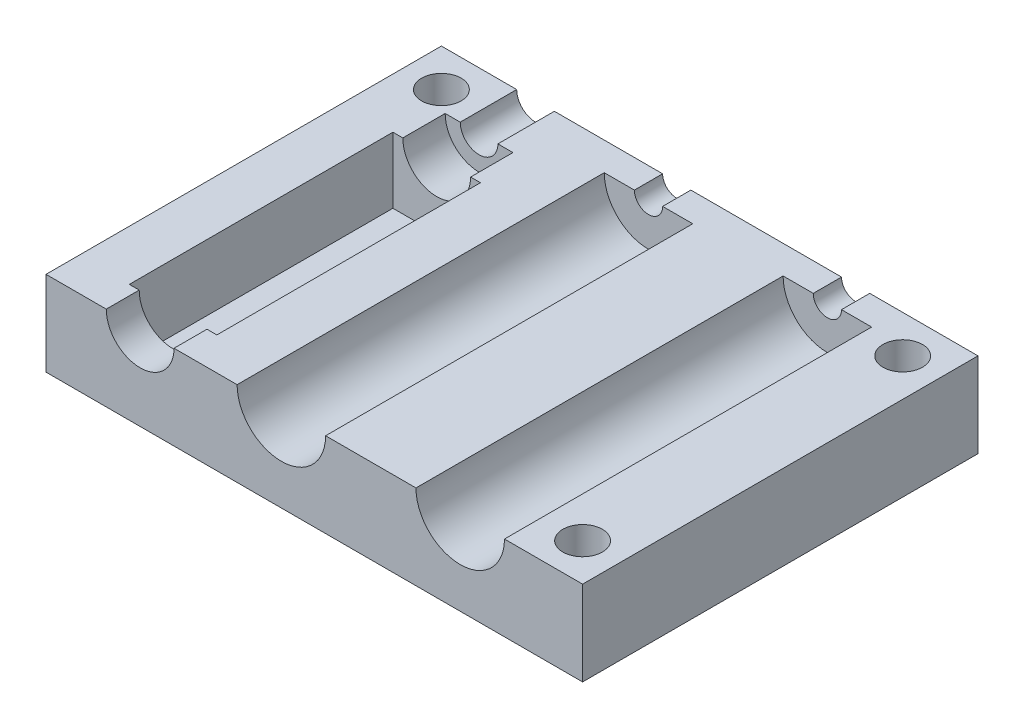
from build123d import *

# Parameters (mm, degrees)
SALIENTE_EXTRUIR1_DEPTH = 39
CROQUIS2_W              = 9.3
CROQUIS2_H              = 28
CORTAR_EXTRUIR1_DEPTH   = 7
SALIENTE_EXTRUIR4_DEPTH = 3
SALIENTE_EXTRUIR5_DEPTH = 3
CROQUIS4_R              = 2.1
CORTAR_EXTRUIR2_DEPTH   = 52.548520832


with BuildPart() as part:
    # Croquis1 → Saliente-Extruir1 (new body)
    with BuildSketch(Plane.XY):
        with BuildLine():
            Line((-22.1, 1), (-28.5, 1))
            Line((-28.5, 1), (-28.5, -8))
            Line((-28.5, -8), (28.5, -8))
            Line((28.5, -8), (28.5, 1))
            Line((28.5, 1), (20.2, 1))
            ThreePointArc((20.2, 1), (15.5, -3.7), (10.8, 1))
            Line((10.8, 1), (1.2, 1))
            ThreePointArc((1.2, 1), (-3.5, -3.7), (-8.2, 1))
            Line((-8.2, 1), (-14.9, 1))
            ThreePointArc((-14.9, 1), (-18.5, -2.6), (-22.1, 1))
        make_face()
    extrude(amount=-SALIENTE_EXTRUIR1_DEPTH)

    # Croquis2 → Cortar-Extruir1 (cut)
    with BuildSketch(Plane(origin=(0, 1, 0), x_dir=(1, 0, 0), z_dir=(0, 1, 0))):
        with Locations((-18.5, 17.5)):
            Rectangle(CROQUIS2_W, CROQUIS2_H)
    extrude(amount=-CORTAR_EXTRUIR1_DEPTH, mode=Mode.SUBTRACT)

    # Croquis3 → Saliente-Extruir4 (add)
    with BuildSketch(Plane(origin=(0, 0, -39), x_dir=(-1, 0, 0), z_dir=(0, 0, -1))):
        with BuildLine():
            Line((-28.5, 1), (-28.5, -8))
            Line((-28.5, -8), (13.5, -8))
            Line((13.5, -8), (13.5, 1))
            Line((13.5, 1), (5, 1))
            ThreePointArc((5, 1), (3.5, -0.5), (2, 1))
            Line((2, 1), (-14, 1))
            ThreePointArc((-14, 1), (-15.5, -0.5), (-17, 1))
            Line((-17, 1), (-28.5, 1))
        make_face()
    extrude(amount=SALIENTE_EXTRUIR4_DEPTH)

    # Croquis3<4> → Saliente-Extruir5 (add, symmetric)
    with BuildSketch(Plane(origin=(0, 0, -39), x_dir=(-1, 0, 0), z_dir=(0, 0, -1))):
        with BuildLine():
            Line((13.5, 1), (13.5, -8))
            Line((13.5, -8), (28.5, -8))
            Line((28.5, -8), (28.5, 1))
            Line((28.5, 1), (20.5, 1))
            ThreePointArc((20.5, 1), (18.5, -1), (16.5, 1))
            Line((16.5, 1), (13.5, 1))
        make_face()
    extrude(amount=SALIENTE_EXTRUIR5_DEPTH, both=True)

    # Croquis4 → Cortar-Extruir2 (cut, through all)
    with BuildSketch(Plane(origin=(0, 1, 0), x_dir=(1, 0, 0), z_dir=(0, 1, 0))):
        with Locations((-24.5, 38)):
            Circle(CROQUIS4_R)
        with Locations((24.5, 38)):
            Circle(CROQUIS4_R)
        with Locations((24.5, 4)):
            Circle(CROQUIS4_R)
    extrude(amount=-CORTAR_EXTRUIR2_DEPTH, mode=Mode.SUBTRACT)


solid = part.part
